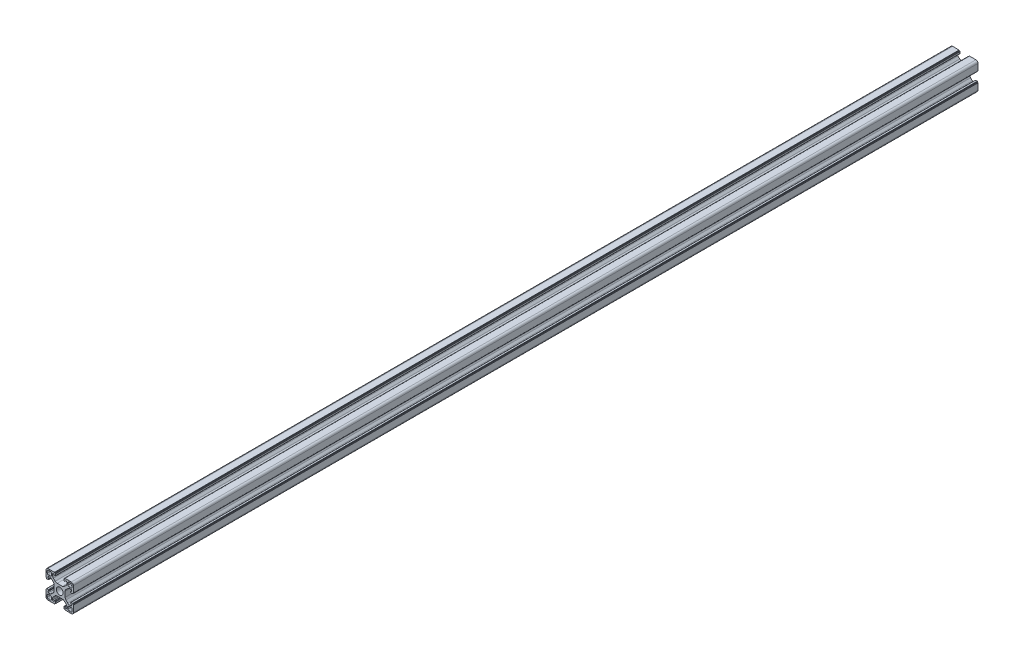
from build123d import *

# Parameters (mm, degrees)
EXTRUDE_1_DEPTH = 660


with BuildPart() as part:
    # Эскиз1 → Бобышка-Вытянуть1 (new body)
    with BuildSketch(Plane.XY):
        with BuildLine():
            Line((-18.466980253, 43.461877394), (-16.568199584, 43.461877394))
            ThreePointArc((-16.568199584, 43.461877394), (-15.80283272, 43.614118329), (-15.153986022, 44.047663832))
            Line((-15.153986022, 44.047663832), (-13.852766691, 45.348883163))
            ThreePointArc((-13.852766691, 45.348883163), (-13.419221188, 45.99772986), (-13.266980253, 46.763096725))
            Line((-13.266980253, 46.763096725), (-13.266980253, 47.661877394))
            ThreePointArc((-13.266980253, 47.661877394), (-13.413426863, 48.015430785), (-13.766980253, 48.161877394))
            Line((-13.766980253, 48.161877394), (-13.869873472, 48.161877394))
            ThreePointArc((-13.869873472, 48.161877394), (-14.061215188, 48.123817161), (-14.223426863, 48.015430785))
            Line((-14.223426863, 48.015430785), (-14.703756949, 47.535100699))
            ThreePointArc((-14.703756949, 47.535100699), (-14.784862786, 47.480907511), (-14.880533644, 47.461877394))
            Line((-14.880533644, 47.461877394), (-15.166980253, 47.461877394))
            ThreePointArc((-15.166980253, 47.461877394), (-15.343756949, 47.535100699), (-15.416980253, 47.711877394))
            Line((-15.416980253, 47.711877394), (-15.416980253, 48.860948215))
            ThreePointArc((-15.416980253, 48.860948215), (-15.373046271, 48.967014232), (-15.266980253, 49.010948215))
            Line((-15.266980253, 49.010948215), (-14.766980253, 49.010948215))
            Line((-14.766980253, 49.010948215), (-14.766980253, 49.311877394))
            ThreePointArc((-14.766980253, 49.311877394), (-14.723046271, 49.417943411), (-14.616980253, 49.461877394))
            Line((-14.616980253, 49.461877394), (-9.966980253, 49.461877394))
            ThreePointArc((-9.966980253, 49.461877394), (-8.906320082, 49.022537566), (-8.466980253, 47.961877394))
            Line((-8.466980253, 47.961877394), (-8.466980253, 43.311877394))
            ThreePointArc((-8.466980253, 43.311877394), (-8.510914236, 43.205811377), (-8.616980253, 43.161877394))
            Line((-8.616980253, 43.161877394), (-8.917909433, 43.161877394))
            Line((-8.917909433, 43.161877394), (-8.917909433, 42.661877394))
            ThreePointArc((-8.917909433, 42.661877394), (-8.961843416, 42.555811377), (-9.067909433, 42.511877394))
            Line((-9.067909433, 42.511877394), (-10.216980253, 42.511877394))
            ThreePointArc((-10.216980253, 42.511877394), (-10.393756949, 42.585100699), (-10.466980253, 42.761877394))
            Line((-10.466980253, 42.761877394), (-10.466980253, 43.048324004))
            ThreePointArc((-10.466980253, 43.048324004), (-10.447950137, 43.143994862), (-10.393756949, 43.225100699))
            Line((-10.393756949, 43.225100699), (-9.913426863, 43.705430785))
            ThreePointArc((-9.913426863, 43.705430785), (-9.805040487, 43.867642459), (-9.766980253, 44.058984175))
            Line((-9.766980253, 44.058984175), (-9.766980253, 44.161877394))
            ThreePointArc((-9.766980253, 44.161877394), (-9.913426863, 44.515430785), (-10.266980253, 44.661877394))
            Line((-10.266980253, 44.661877394), (-11.165760923, 44.661877394))
            ThreePointArc((-11.165760923, 44.661877394), (-11.931127787, 44.509636459), (-12.579974485, 44.076090957))
            Line((-12.579974485, 44.076090957), (-13.881193816, 42.774871626))
            ThreePointArc((-13.881193816, 42.774871626), (-14.314739319, 42.126024928), (-14.466980253, 41.360658063))
            Line((-14.466980253, 41.360658063), (-14.466980253, 39.461877394))
            Line((-14.466980253, 39.461877394), (-14.466980253, 37.563096725))
            ThreePointArc((-14.466980253, 37.563096725), (-14.314739319, 36.79772986), (-13.881193816, 36.148883163))
            Line((-13.881193816, 36.148883163), (-12.579974485, 34.847663832))
            ThreePointArc((-12.579974485, 34.847663832), (-11.931127787, 34.414118329), (-11.165760923, 34.261877394))
            Line((-11.165760923, 34.261877394), (-10.266980253, 34.261877394))
            ThreePointArc((-10.266980253, 34.261877394), (-9.913426863, 34.408324004), (-9.766980253, 34.761877394))
            Line((-9.766980253, 34.761877394), (-9.766980253, 34.864770613))
            ThreePointArc((-9.766980253, 34.864770613), (-9.805040487, 35.056112329), (-9.913426863, 35.218324004))
            Line((-9.913426863, 35.218324004), (-10.393756949, 35.69865409))
            ThreePointArc((-10.393756949, 35.69865409), (-10.447950137, 35.779759927), (-10.466980253, 35.875430785))
            Line((-10.466980253, 35.875430785), (-10.466980253, 36.161877394))
            ThreePointArc((-10.466980253, 36.161877394), (-10.393756949, 36.33865409), (-10.216980253, 36.411877394))
            Line((-10.216980253, 36.411877394), (-9.067909433, 36.411877394))
            ThreePointArc((-9.067909433, 36.411877394), (-8.961843416, 36.367943411), (-8.917909433, 36.261877394))
            Line((-8.917909433, 36.261877394), (-8.917909433, 35.761877394))
            Line((-8.917909433, 35.761877394), (-8.616980253, 35.761877394))
            ThreePointArc((-8.616980253, 35.761877394), (-8.510914236, 35.717943411), (-8.466980253, 35.611877394))
            Line((-8.466980253, 35.611877394), (-8.466980253, 30.961877394))
            ThreePointArc((-8.466980253, 30.961877394), (-8.906320082, 29.901217222), (-9.966980253, 29.461877394))
            Line((-9.966980253, 29.461877394), (-14.616980253, 29.461877394))
            ThreePointArc((-14.616980253, 29.461877394), (-14.723046271, 29.505811377), (-14.766980253, 29.611877394))
            Line((-14.766980253, 29.611877394), (-14.766980253, 29.912806574))
            Line((-14.766980253, 29.912806574), (-15.266980253, 29.912806574))
            ThreePointArc((-15.266980253, 29.912806574), (-15.373046271, 29.956740557), (-15.416980253, 30.062806574))
            Line((-15.416980253, 30.062806574), (-15.416980253, 31.211877394))
            ThreePointArc((-15.416980253, 31.211877394), (-15.343756949, 31.38865409), (-15.166980253, 31.461877394))
            Line((-15.166980253, 31.461877394), (-14.880533644, 31.461877394))
            ThreePointArc((-14.880533644, 31.461877394), (-14.784862786, 31.442847277), (-14.703756949, 31.38865409))
            Line((-14.703756949, 31.38865409), (-14.223426863, 30.908324004))
            ThreePointArc((-14.223426863, 30.908324004), (-14.061215188, 30.799937628), (-13.869873472, 30.761877394))
            Line((-13.869873472, 30.761877394), (-13.766980253, 30.761877394))
            ThreePointArc((-13.766980253, 30.761877394), (-13.413426863, 30.908324004), (-13.266980253, 31.261877394))
            Line((-13.266980253, 31.261877394), (-13.266980253, 32.160658063))
            ThreePointArc((-13.266980253, 32.160658063), (-13.419221188, 32.926024928), (-13.852766691, 33.574871626))
            Line((-13.852766691, 33.574871626), (-15.153986022, 34.876090957))
            ThreePointArc((-15.153986022, 34.876090957), (-15.80283272, 35.309636459), (-16.568199584, 35.461877394))
            Line((-16.568199584, 35.461877394), (-18.466980253, 35.461877394))
            Line((-18.466980253, 35.461877394), (-20.365760923, 35.461877394))
            ThreePointArc((-20.365760923, 35.461877394), (-21.131127787, 35.309636459), (-21.779974485, 34.876090957))
            Line((-21.779974485, 34.876090957), (-23.081193816, 33.574871626))
            ThreePointArc((-23.081193816, 33.574871626), (-23.514739319, 32.926024928), (-23.666980253, 32.160658063))
            Line((-23.666980253, 32.160658063), (-23.666980253, 31.261877394))
            ThreePointArc((-23.666980253, 31.261877394), (-23.520533644, 30.908324004), (-23.166980253, 30.761877394))
            Line((-23.166980253, 30.761877394), (-23.064087035, 30.761877394))
            ThreePointArc((-23.064087035, 30.761877394), (-22.872745319, 30.799937628), (-22.710533644, 30.908324004))
            Line((-22.710533644, 30.908324004), (-22.230203558, 31.38865409))
            ThreePointArc((-22.230203558, 31.38865409), (-22.149097721, 31.442847277), (-22.053426863, 31.461877394))
            Line((-22.053426863, 31.461877394), (-21.766980253, 31.461877394))
            ThreePointArc((-21.766980253, 31.461877394), (-21.590203558, 31.38865409), (-21.516980253, 31.211877394))
            Line((-21.516980253, 31.211877394), (-21.516980253, 30.062806574))
            ThreePointArc((-21.516980253, 30.062806574), (-21.560914236, 29.956740557), (-21.666980253, 29.912806574))
            Line((-21.666980253, 29.912806574), (-22.166980253, 29.912806574))
            Line((-22.166980253, 29.912806574), (-22.166980253, 29.611877394))
            ThreePointArc((-22.166980253, 29.611877394), (-22.210914236, 29.505811377), (-22.316980253, 29.461877394))
            Line((-22.316980253, 29.461877394), (-26.966980253, 29.461877394))
            ThreePointArc((-26.966980253, 29.461877394), (-28.027640425, 29.901217222), (-28.466980253, 30.961877394))
            Line((-28.466980253, 30.961877394), (-28.466980253, 35.611877394))
            ThreePointArc((-28.466980253, 35.611877394), (-28.423046271, 35.717943411), (-28.316980253, 35.761877394))
            Line((-28.316980253, 35.761877394), (-28.016051074, 35.761877394))
            Line((-28.016051074, 35.761877394), (-28.016051074, 36.261877394))
            ThreePointArc((-28.016051074, 36.261877394), (-27.972117091, 36.367943411), (-27.866051074, 36.411877394))
            Line((-27.866051074, 36.411877394), (-26.716980253, 36.411877394))
            ThreePointArc((-26.716980253, 36.411877394), (-26.540203558, 36.33865409), (-26.466980253, 36.161877394))
            Line((-26.466980253, 36.161877394), (-26.466980253, 35.875430785))
            ThreePointArc((-26.466980253, 35.875430785), (-26.48601037, 35.779759927), (-26.540203558, 35.69865409))
            Line((-26.540203558, 35.69865409), (-27.020533644, 35.218324004))
            ThreePointArc((-27.020533644, 35.218324004), (-27.12892002, 35.056112329), (-27.166980253, 34.864770613))
            Line((-27.166980253, 34.864770613), (-27.166980253, 34.761877394))
            ThreePointArc((-27.166980253, 34.761877394), (-27.020533644, 34.408324004), (-26.666980253, 34.261877394))
            Line((-26.666980253, 34.261877394), (-25.768199584, 34.261877394))
            ThreePointArc((-25.768199584, 34.261877394), (-25.00283272, 34.414118329), (-24.353986022, 34.847663832))
            Line((-24.353986022, 34.847663832), (-23.052766691, 36.148883163))
            ThreePointArc((-23.052766691, 36.148883163), (-22.619221188, 36.79772986), (-22.466980253, 37.563096725))
            Line((-22.466980253, 37.563096725), (-22.466980253, 39.461877394))
            Line((-22.466980253, 39.461877394), (-22.466980253, 41.360658063))
            ThreePointArc((-22.466980253, 41.360658063), (-22.619221188, 42.126024928), (-23.052766691, 42.774871626))
            Line((-23.052766691, 42.774871626), (-24.353986022, 44.076090957))
            ThreePointArc((-24.353986022, 44.076090957), (-25.00283272, 44.509636459), (-25.768199584, 44.661877394))
            Line((-25.768199584, 44.661877394), (-26.666980253, 44.661877394))
            ThreePointArc((-26.666980253, 44.661877394), (-27.020533644, 44.515430785), (-27.166980253, 44.161877394))
            Line((-27.166980253, 44.161877394), (-27.166980253, 44.058984175))
            ThreePointArc((-27.166980253, 44.058984175), (-27.12892002, 43.867642459), (-27.020533644, 43.705430785))
            Line((-27.020533644, 43.705430785), (-26.540203558, 43.225100699))
            ThreePointArc((-26.540203558, 43.225100699), (-26.48601037, 43.143994862), (-26.466980253, 43.048324004))
            Line((-26.466980253, 43.048324004), (-26.466980253, 42.761877394))
            ThreePointArc((-26.466980253, 42.761877394), (-26.540203558, 42.585100699), (-26.716980253, 42.511877394))
            Line((-26.716980253, 42.511877394), (-27.866051074, 42.511877394))
            ThreePointArc((-27.866051074, 42.511877394), (-27.972117091, 42.555811377), (-28.016051074, 42.661877394))
            Line((-28.016051074, 42.661877394), (-28.016051074, 43.161877394))
            Line((-28.016051074, 43.161877394), (-28.316980253, 43.161877394))
            ThreePointArc((-28.316980253, 43.161877394), (-28.423046271, 43.205811377), (-28.466980253, 43.311877394))
            Line((-28.466980253, 43.311877394), (-28.466980253, 47.961877394))
            ThreePointArc((-28.466980253, 47.961877394), (-28.027640425, 49.022537566), (-26.966980253, 49.461877394))
            Line((-26.966980253, 49.461877394), (-22.316980253, 49.461877394))
            ThreePointArc((-22.316980253, 49.461877394), (-22.210914236, 49.417943411), (-22.166980253, 49.311877394))
            Line((-22.166980253, 49.311877394), (-22.166980253, 49.010948215))
            Line((-22.166980253, 49.010948215), (-21.666980253, 49.010948215))
            ThreePointArc((-21.666980253, 49.010948215), (-21.560914236, 48.967014232), (-21.516980253, 48.860948215))
            Line((-21.516980253, 48.860948215), (-21.516980253, 47.711877394))
            ThreePointArc((-21.516980253, 47.711877394), (-21.590203558, 47.535100699), (-21.766980253, 47.461877394))
            Line((-21.766980253, 47.461877394), (-22.053426863, 47.461877394))
            ThreePointArc((-22.053426863, 47.461877394), (-22.149097721, 47.480907511), (-22.230203558, 47.535100699))
            Line((-22.230203558, 47.535100699), (-22.710533644, 48.015430785))
            ThreePointArc((-22.710533644, 48.015430785), (-22.872745319, 48.123817161), (-23.064087035, 48.161877394))
            Line((-23.064087035, 48.161877394), (-23.166980253, 48.161877394))
            ThreePointArc((-23.166980253, 48.161877394), (-23.520533644, 48.015430785), (-23.666980253, 47.661877394))
            Line((-23.666980253, 47.661877394), (-23.666980253, 46.763096725))
            ThreePointArc((-23.666980253, 46.763096725), (-23.514739319, 45.99772986), (-23.081193816, 45.348883163))
            Line((-23.081193816, 45.348883163), (-21.779974485, 44.047663832))
            ThreePointArc((-21.779974485, 44.047663832), (-21.131127787, 43.614118329), (-20.365760923, 43.461877394))
            Line((-20.365760923, 43.461877394), (-18.466980253, 43.461877394))
        make_face()
        with BuildLine():
            Line((-11.566980253, 45.561877394), (-10.166980253, 45.561877394))
            ThreePointArc((-10.166980253, 45.561877394), (-9.601294829, 45.796191969), (-9.366980253, 46.361877394))
            Line((-9.366980253, 46.361877394), (-9.366980253, 47.761877394))
            ThreePointArc((-9.366980253, 47.761877394), (-9.601294829, 48.327562819), (-10.166980253, 48.561877394))
            Line((-10.166980253, 48.561877394), (-11.566980253, 48.561877394))
            ThreePointArc((-11.566980253, 48.561877394), (-12.132665678, 48.327562819), (-12.366980253, 47.761877394))
            Line((-12.366980253, 47.761877394), (-12.366980253, 46.361877394))
            ThreePointArc((-12.366980253, 46.361877394), (-12.132665678, 45.796191969), (-11.566980253, 45.561877394))
        make_face(mode=Mode.SUBTRACT)
        with BuildLine():
            Line((-12.366980253, 32.561877394), (-12.366980253, 31.161877394))
            ThreePointArc((-12.366980253, 31.161877394), (-12.132665678, 30.596191969), (-11.566980253, 30.361877394))
            Line((-11.566980253, 30.361877394), (-10.166980253, 30.361877394))
            ThreePointArc((-10.166980253, 30.361877394), (-9.601294829, 30.596191969), (-9.366980253, 31.161877394))
            Line((-9.366980253, 31.161877394), (-9.366980253, 32.561877394))
            ThreePointArc((-9.366980253, 32.561877394), (-9.601294829, 33.127562819), (-10.166980253, 33.361877394))
            Line((-10.166980253, 33.361877394), (-11.566980253, 33.361877394))
            ThreePointArc((-11.566980253, 33.361877394), (-12.132665678, 33.127562819), (-12.366980253, 32.561877394))
        make_face(mode=Mode.SUBTRACT)
        with BuildLine():
            Line((-25.366980253, 33.361877394), (-26.766980253, 33.361877394))
            ThreePointArc((-26.766980253, 33.361877394), (-27.332665678, 33.127562819), (-27.566980253, 32.561877394))
            Line((-27.566980253, 32.561877394), (-27.566980253, 31.161877394))
            ThreePointArc((-27.566980253, 31.161877394), (-27.332665678, 30.596191969), (-26.766980253, 30.361877394))
            Line((-26.766980253, 30.361877394), (-25.366980253, 30.361877394))
            ThreePointArc((-25.366980253, 30.361877394), (-24.801294829, 30.596191969), (-24.566980253, 31.161877394))
            Line((-24.566980253, 31.161877394), (-24.566980253, 32.561877394))
            ThreePointArc((-24.566980253, 32.561877394), (-24.801294829, 33.127562819), (-25.366980253, 33.361877394))
        make_face(mode=Mode.SUBTRACT)
        with BuildLine():
            Line((-24.566980253, 46.361877394), (-24.566980253, 47.761877394))
            ThreePointArc((-24.566980253, 47.761877394), (-24.801294829, 48.327562819), (-25.366980253, 48.561877394))
            Line((-25.366980253, 48.561877394), (-26.766980253, 48.561877394))
            ThreePointArc((-26.766980253, 48.561877394), (-27.332665678, 48.327562819), (-27.566980253, 47.761877394))
            Line((-27.566980253, 47.761877394), (-27.566980253, 46.361877394))
            ThreePointArc((-27.566980253, 46.361877394), (-27.332665678, 45.796191969), (-26.766980253, 45.561877394))
            Line((-26.766980253, 45.561877394), (-25.366980253, 45.561877394))
            ThreePointArc((-25.366980253, 45.561877394), (-24.801294829, 45.796191969), (-24.566980253, 46.361877394))
        make_face(mode=Mode.SUBTRACT)
        with BuildLine():
            ThreePointArc((-15.966980253, 39.461877394), (-16.699213301, 41.229644347), (-18.466980253, 41.961877394))
            ThreePointArc((-18.466980253, 41.961877394), (-20.234747206, 41.229644347), (-20.966980253, 39.461877394))
            ThreePointArc((-20.966980253, 39.461877394), (-20.234747206, 37.694110441), (-18.466980253, 36.961877394))
            ThreePointArc((-18.466980253, 36.961877394), (-16.699213301, 37.694110441), (-15.966980253, 39.461877394))
        make_face(mode=Mode.SUBTRACT)
    extrude(amount=EXTRUDE_1_DEPTH)


solid = part.part
